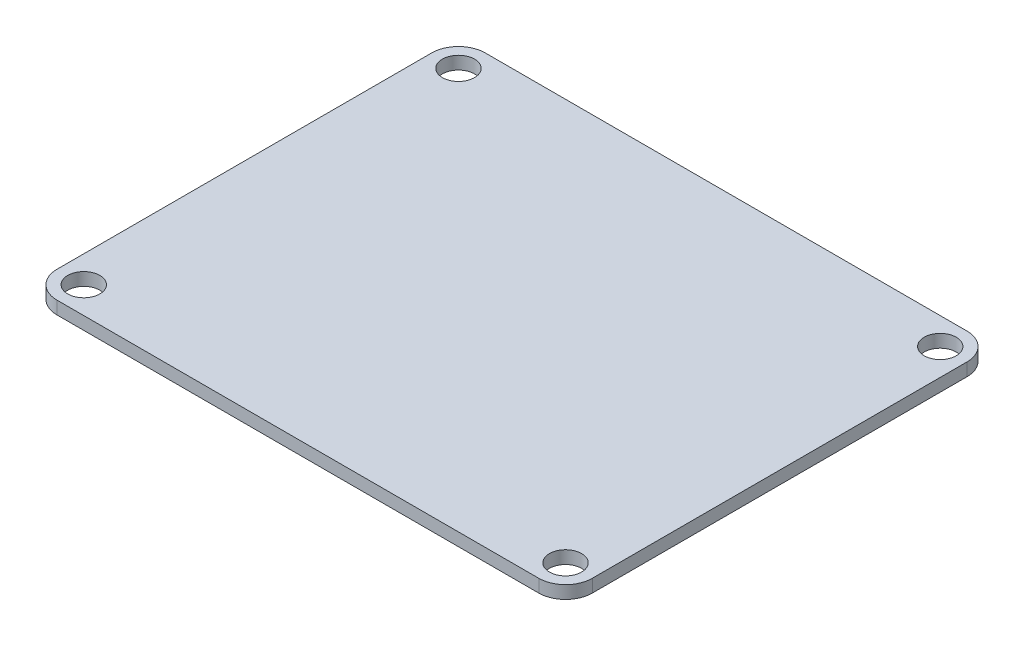
from build123d import *

# Parameters (mm, degrees)
EXTRUDE_3_DEPTH     = 1.2
SKETCH_7_R          = 1.5
CUT_EXTRUDE_1_DEPTH = 62.243591584


with BuildPart() as part:
    # 草图1 → 凸台-拉伸3 (new body)
    with BuildSketch(Plane(origin=(0, 0, 0), x_dir=(1, 0, 0), z_dir=(0, 1, 0))):
        with BuildLine():
            Line((-55.213994356, 19.544380587), (-10.213994356, 19.544380587))
            ThreePointArc((-10.213994356, 19.544380587), (-8.446227403, 18.81214754), (-7.713994356, 17.044380587))
            Line((-7.713994356, 17.044380587), (-7.713994356, -17.955619413))
            ThreePointArc((-7.713994356, -17.955619413), (-8.446227403, -19.723386366), (-10.213994356, -20.455619413))
            Line((-10.213994356, -20.455619413), (-55.213994356, -20.455619413))
            ThreePointArc((-55.213994356, -20.455619413), (-56.981761309, -19.723386366), (-57.713994356, -17.955619413))
            Line((-57.713994356, -17.955619413), (-57.713994356, 17.044380587))
            ThreePointArc((-57.713994356, 17.044380587), (-56.981761309, 18.81214754), (-55.213994356, 19.544380587))
        make_face()
    extrude(amount=EXTRUDE_3_DEPTH)

    # 草图7 → 切除-拉伸1 (cut, through all)
    with BuildSketch(Plane(origin=(0, 1.2, 0), x_dir=(1, 0, 0), z_dir=(0, 1, 0))):
        with Locations(Location((-55.213994356, 17.044380587, 0), (0, 0, 270))):
            Circle(SKETCH_7_R)
        with Locations(Location((-10.213994356, 17.044380587, 0), (0, 0, 270))):
            Circle(SKETCH_7_R)
        with Locations(Location((-55.213994356, -17.955619413, 0), (0, 0, 270))):
            Circle(SKETCH_7_R)
        with Locations(Location((-10.213994356, -17.955619413, 0), (0, 0, 270))):
            Circle(SKETCH_7_R)
    extrude(amount=-CUT_EXTRUDE_1_DEPTH, mode=Mode.SUBTRACT)


solid = part.part
